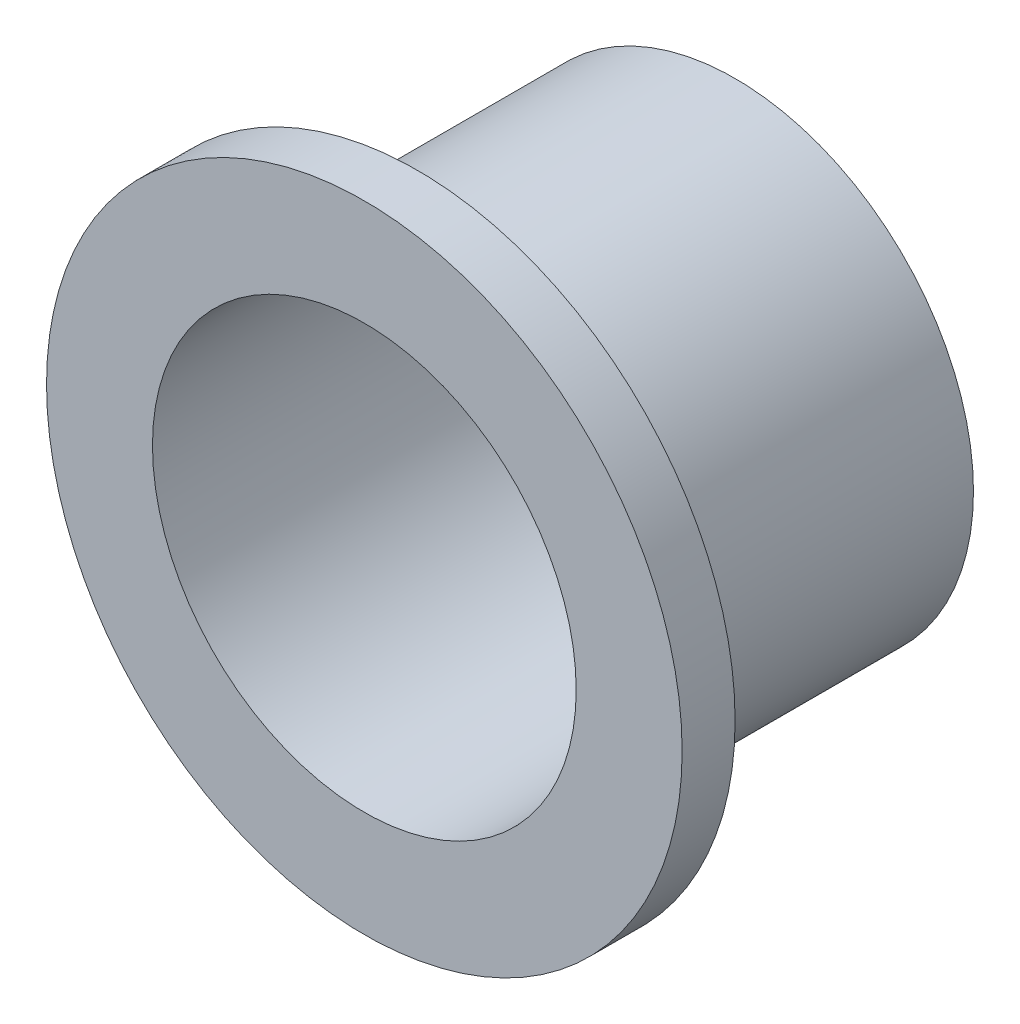
from build123d import *

# Parameters (mm, degrees)
SKETCH1_R           = 19.05
BOSS_EXTRUDE1_DEPTH = 22.225
SKETCH2_R           = 19.05
SKETCH2_R_2         = 14.2875
CUT_EXTRUDE1_DEPTH  = 19.05
SKETCH3_R           = 12.7
CUT_EXTRUDE2_DEPTH  = 35.925


with BuildPart() as part:
    # Sketch1 → Boss-Extrude1 (new body)
    with BuildSketch(Plane.XY):
        Circle(SKETCH1_R)
    extrude(amount=BOSS_EXTRUDE1_DEPTH)

    # Sketch2 → Cut-Extrude1 (cut)
    with BuildSketch(Plane(origin=(0, 0, 0), x_dir=(-1, 0, 0), z_dir=(0, 0, -1))):
        Circle(SKETCH2_R)
        Circle(SKETCH2_R_2, mode=Mode.SUBTRACT)
    extrude(amount=-CUT_EXTRUDE1_DEPTH, mode=Mode.SUBTRACT)

    # Sketch3 → Cut-Extrude2 (cut, through all)
    with BuildSketch(Plane.XY.offset(22.225)):
        Circle(SKETCH3_R)
    extrude(amount=-CUT_EXTRUDE2_DEPTH, mode=Mode.SUBTRACT)


solid = part.part
